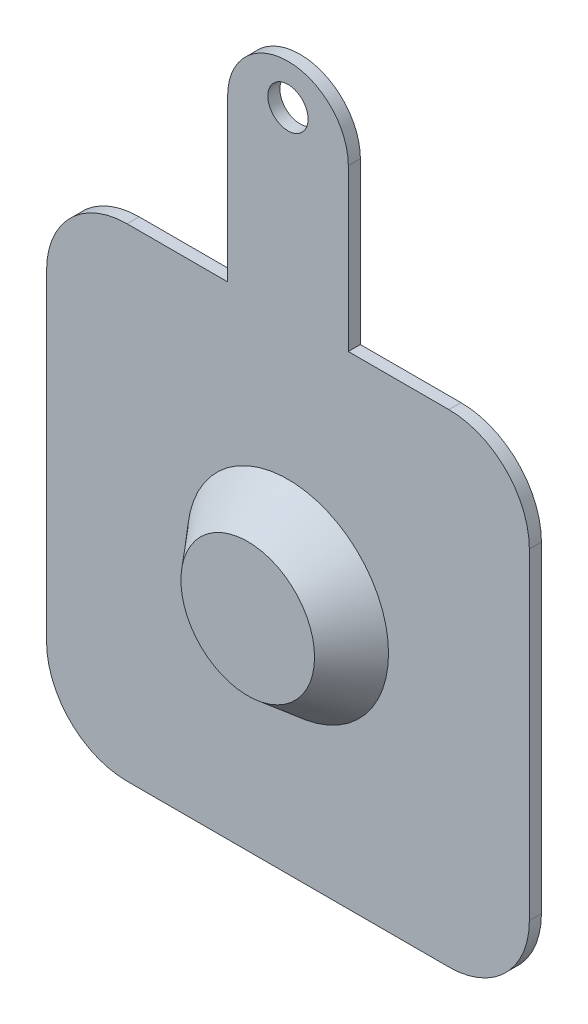
from build123d import *

# Parameters (mm, degrees)
EXTRUDE_1_DEPTH     = 0.3
FILLET_1_R          = 2
SKETCH_2_R          = 2.5
EXTRUDE_2_DEPTH     = 1
EXTRUDE_2_TAPER     = 40
SKETCH_3_R          = 0.5
CUT_EXTRUDE_1_DEPTH = 1


with BuildPart() as part:
    # 草图1 → 凸台-拉伸1 (new body)
    with BuildSketch(Plane.XY):
        with BuildLine():
            Line((-7.5, 12), (-12, 12))
            Line((-12, 12), (-12, 0))
            Line((-12, 0), (0, 0))
            Line((0, 0), (0, 12))
            Line((0, 12), (-4.5, 12))
            Line((-4.5, 12), (-4.5, 16))
            ThreePointArc((-4.5, 16), (-6, 17.5), (-7.5, 16))
            Line((-7.5, 16), (-7.5, 12))
        make_face()
    extrude(amount=EXTRUDE_1_DEPTH)

    # 圆角1
    fillet_1_edges = [part.edges().sort_by_distance(p)[0] for p in [
        (0, 0, 0.15),
        (-12, 0, 0.15),
        (-12, 12, 0.15),
        (0, 12, 0.15),
    ]]
    fillet(fillet_1_edges, radius=FILLET_1_R)

    # 草图2 → 凸台-拉伸2 (add)
    with BuildSketch(Plane.XY.offset(0.3)):
        with Locations((-6, 6)):
            Circle(SKETCH_2_R)
    extrude(amount=EXTRUDE_2_DEPTH, taper=EXTRUDE_2_TAPER)

    # 草图3 → 切除-拉伸1 (cut)
    with BuildSketch(Plane.XY.offset(0.3)):
        with Locations((-6, 16.5)):
            Circle(SKETCH_3_R)
    extrude(amount=-CUT_EXTRUDE_1_DEPTH, mode=Mode.SUBTRACT)


solid = part.part
